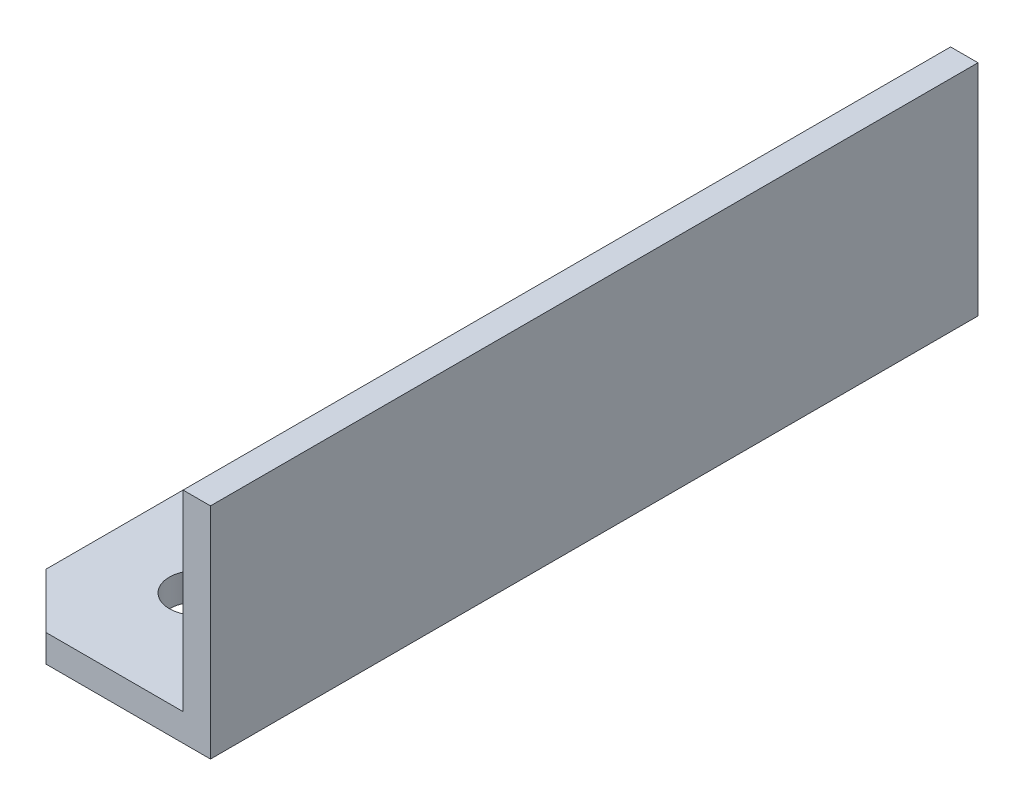
from build123d import *

# Parameters (mm, degrees)
EXTRUDE_THIN1_DEPTH      = 70
EXTRUDE_THIN1_DEPTH_BACK = 70
CHAMFER1_SIZE            = 10
SKETCH2_R                = 5
CUT_EXTRUDE1_DEPTH       = 10


with BuildPart() as part:
    # Sketch1 → Extrude-Thin1 (new, two sides: drawn at the far end of the back side and taken through both)
    with BuildSketch(Plane.XY.offset(-EXTRUDE_THIN1_DEPTH_BACK)):
        Polygon((-40, 0), (0, 0), (0, 40), (-5, 40), (-5, 5), (-40, 5), align=None)
    extrude(amount=EXTRUDE_THIN1_DEPTH + EXTRUDE_THIN1_DEPTH_BACK)

    # Chamfer1
    chamfer1_edges = [part.edges().sort_by_distance(p)[0] for p in [
        (-40, 2.5, 70),
        (-40, 2.5, -70),
    ]]
    chamfer(chamfer1_edges, length=CHAMFER1_SIZE)

    # Sketch2 → Cut-Extrude1 (cut)
    with BuildSketch(Plane(origin=(0, 5, 0), x_dir=(1, 0, 0), z_dir=(0, 1, 0))):
        with Locations(Location((-22.5, 50, 0), (0, 0, 270))):
            Circle(SKETCH2_R)
        with Locations(Location((-22.5, -50, 0), (0, 0, 270))):
            Circle(SKETCH2_R)
    extrude(amount=-CUT_EXTRUDE1_DEPTH, mode=Mode.SUBTRACT)


solid = part.part
